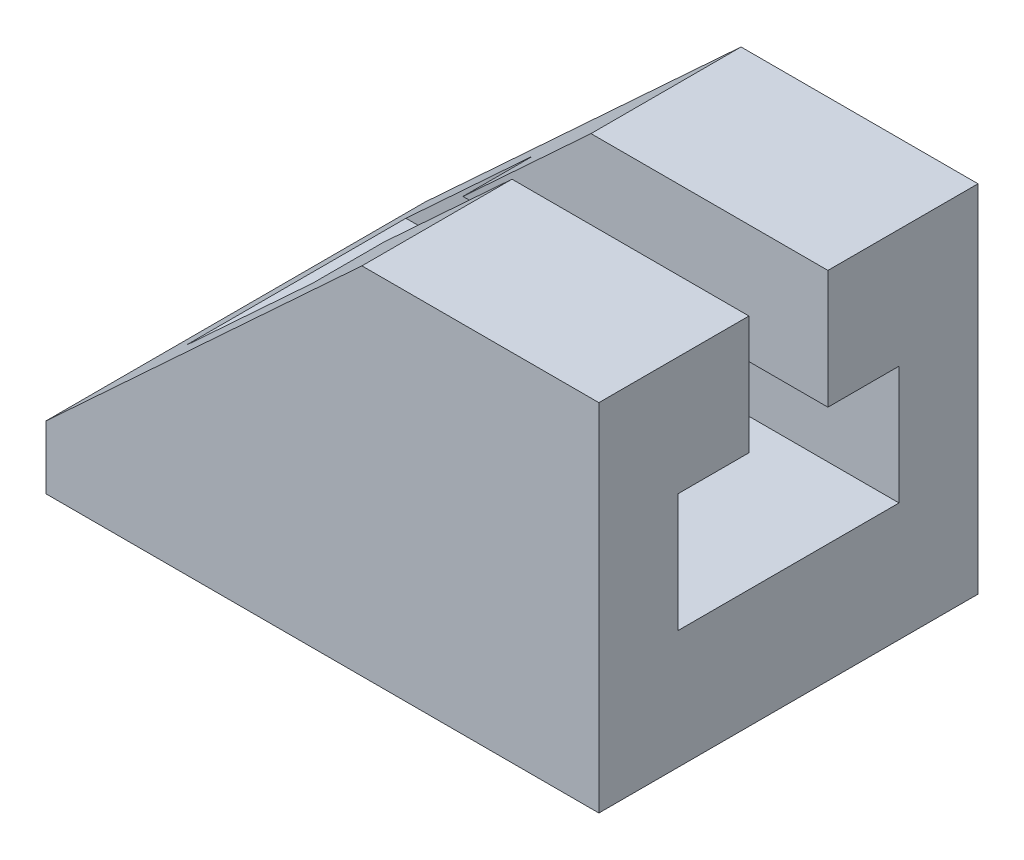
from build123d import *

# Parameters (mm, degrees)
BOSS_EXTRUDE1_DEPTH = 48
CUT_EXTRUDE1_DEPTH  = 70


with BuildPart() as part:
    # Sketch1 → Boss-Extrude1 (new body)
    with BuildSketch(Plane.XY):
        Polygon((-73.692653745, -34.694240524), (-3.692653745, -34.694240524), (-3.692653745, 10.305759476), (-33.692653745, 10.305759476), (-73.692653745, -26.694240524), align=None)
    extrude(amount=BOSS_EXTRUDE1_DEPTH)

    # Sketch2 → Cut-Extrude1 (cut)
    with BuildSketch(Plane.ZY.offset(73.692653745)):
        Polygon((19, 10.305759476), (29, 10.305759476), (29, -4.694240524), (38, -4.694240524), (38, -19.694240524), (10, -19.694240524), (10, -4.694240524), (19, -4.694240524), align=None)
    extrude(amount=-CUT_EXTRUDE1_DEPTH, mode=Mode.SUBTRACT)


solid = part.part
